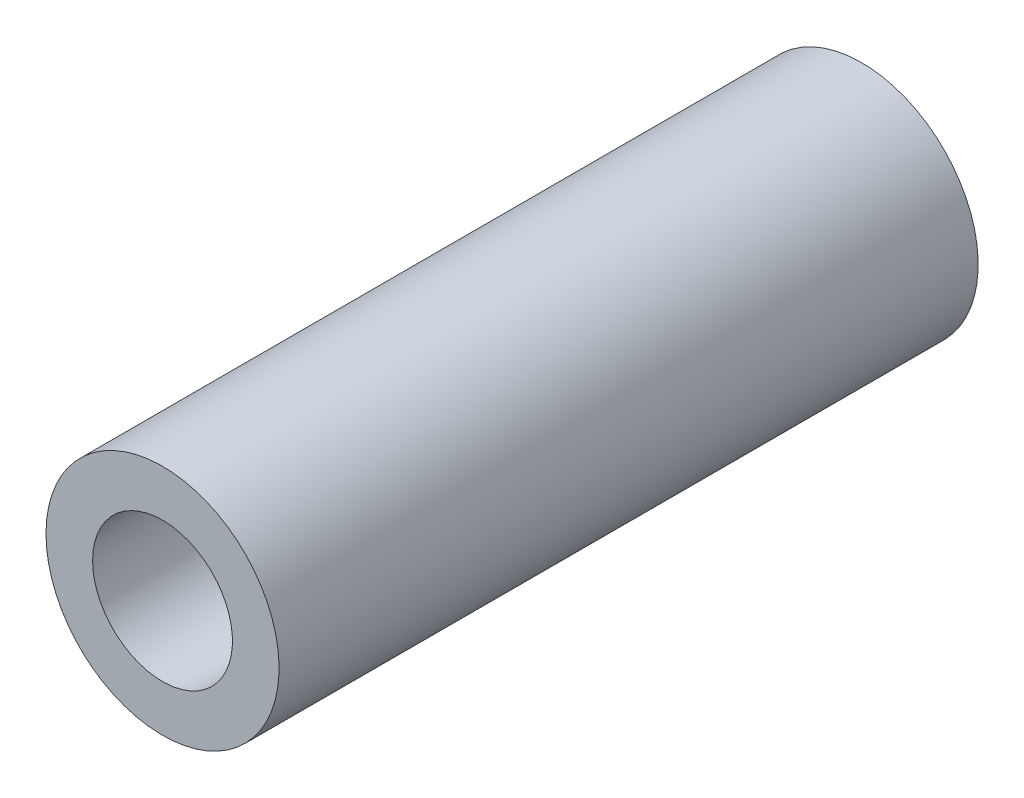
from build123d import *

# Parameters (mm, degrees)
SKETCH_1_R      = 7.5
SKETCH_1_R_2    = 4.5
EXTRUDE_1_DEPTH = 22.5


with BuildPart() as part:
    # 草图1 → 凸台-拉伸1 (new, symmetric)
    with BuildSketch(Plane.XY):
        with Locations(Location((0, 0, 0), (0, 0, 180))):
            Circle(SKETCH_1_R)
        with Locations(Location((0, 0, 0), (0, 0, 180))):
            Circle(SKETCH_1_R_2, mode=Mode.SUBTRACT)
    extrude(amount=EXTRUDE_1_DEPTH, both=True)


solid = part.part
